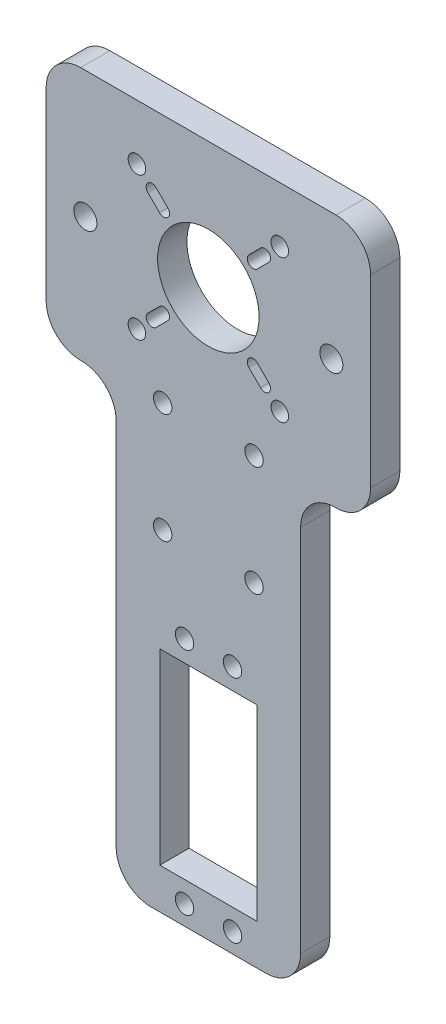
from build123d import *

# Parameters (mm, degrees)
SKETCH1_R           = 2
SKETCH1_R_2         = 11
SKETCH1_R_3         = 1.905
SKETCH1_R_4         = 2.5
SKETCH1_W           = 21.082
SKETCH1_H           = 40.64
BOSS_EXTRUDE1_DEPTH = 3.175
FILLET1_R           = 7.5


with BuildPart() as part:
    # Sketch1 → Boss-Extrude1 (new, symmetric)
    with BuildSketch(Plane.XY):
        Polygon((-20, -84), (20, -84), (20, 11), (35.179, 11), (35.179, 66), (-35.179, 66), (-35.179, 11), (-20, 11), align=None)
        with Locations((9.906, 11.938)):
            Circle(SKETCH1_R, mode=Mode.SUBTRACT)
        with Locations((-9.906, 11.938)):
            Circle(SKETCH1_R, mode=Mode.SUBTRACT)
        with Locations((-9.906, -11.938)):
            Circle(SKETCH1_R, mode=Mode.SUBTRACT)
        with Locations((9.906, -11.938)):
            Circle(SKETCH1_R, mode=Mode.SUBTRACT)
        with Locations((0, 38.5)):
            Circle(SKETCH1_R_2, mode=Mode.SUBTRACT)
        with Locations((15.494, 53.994)):
            Circle(SKETCH1_R_3, mode=Mode.SUBTRACT)
        with Locations((-5.1689, -30)):
            Circle(SKETCH1_R, mode=Mode.SUBTRACT)
        with Locations((5.2451, -30)):
            Circle(SKETCH1_R, mode=Mode.SUBTRACT)
        with Locations((5.2451, -79.784)):
            Circle(SKETCH1_R, mode=Mode.SUBTRACT)
        with Locations((-5.1689, -79.784)):
            Circle(SKETCH1_R, mode=Mode.SUBTRACT)
        with Locations((-26.67, 38.5)):
            Circle(SKETCH1_R_4, mode=Mode.SUBTRACT)
        with Locations((26.67, 38.5)):
            Circle(SKETCH1_R_4, mode=Mode.SUBTRACT)
        with Locations((15.494, 23.006)):
            Circle(SKETCH1_R_3, mode=Mode.SUBTRACT)
        with Locations((-15.494, 23.006)):
            Circle(SKETCH1_R_3, mode=Mode.SUBTRACT)
        with Locations((-15.494, 53.994)):
            Circle(SKETCH1_R_3, mode=Mode.SUBTRACT)
        with BuildLine():
            Line((8.804893639, 49.100944864), (11.319365353, 51.615416577))
            ThreePointArc((11.319365353, 51.615416577), (13.115416577, 51.615416577), (13.115416577, 49.819365353))
            Line((13.115416577, 49.819365353), (10.600944864, 47.304893639))
            ThreePointArc((10.600944864, 47.304893639), (8.804893639, 47.304893639), (8.804893639, 49.100944864))
        make_face(mode=Mode.SUBTRACT)
        with Locations((0, -54.892)):
            Rectangle(SKETCH1_W, SKETCH1_H, mode=Mode.SUBTRACT)
        with BuildLine():
            Line((10.600944864, 29.695106361), (13.115416577, 27.180634647))
            ThreePointArc((13.115416577, 27.180634647), (13.115416577, 25.384583423), (11.319365353, 25.384583423))
            Line((11.319365353, 25.384583423), (8.804893639, 27.899055136))
            ThreePointArc((8.804893639, 27.899055136), (8.804893639, 29.695106361), (10.600944864, 29.695106361))
        make_face(mode=Mode.SUBTRACT)
        with BuildLine():
            Line((-8.804893639, 27.899055136), (-11.319365353, 25.384583423))
            ThreePointArc((-11.319365353, 25.384583423), (-13.115416577, 25.384583423), (-13.115416577, 27.180634647))
            Line((-13.115416577, 27.180634647), (-10.600944864, 29.695106361))
            ThreePointArc((-10.600944864, 29.695106361), (-8.804893639, 29.695106361), (-8.804893639, 27.899055136))
        make_face(mode=Mode.SUBTRACT)
        with BuildLine():
            Line((-10.600944864, 47.304893639), (-13.115416577, 49.819365353))
            ThreePointArc((-13.115416577, 49.819365353), (-13.115416577, 51.615416577), (-11.319365353, 51.615416577))
            Line((-11.319365353, 51.615416577), (-8.804893639, 49.100944864))
            ThreePointArc((-8.804893639, 49.100944864), (-8.804893639, 47.304893639), (-10.600944864, 47.304893639))
        make_face(mode=Mode.SUBTRACT)
    extrude(amount=BOSS_EXTRUDE1_DEPTH, both=True)

    # Fillet1
    fillet1_edges = [part.edges().sort_by_distance(p)[0] for p in [
        (20, -84, 0),
        (-20, -84, 0),
        (-20, 11, 0),
        (-35.179, 11, 0),
        (-35.179, 66, 0),
        (35.179, 66, 0),
        (35.179, 11, 0),
        (20, 11, 0),
    ]]
    fillet(fillet1_edges, radius=FILLET1_R)


solid = part.part
